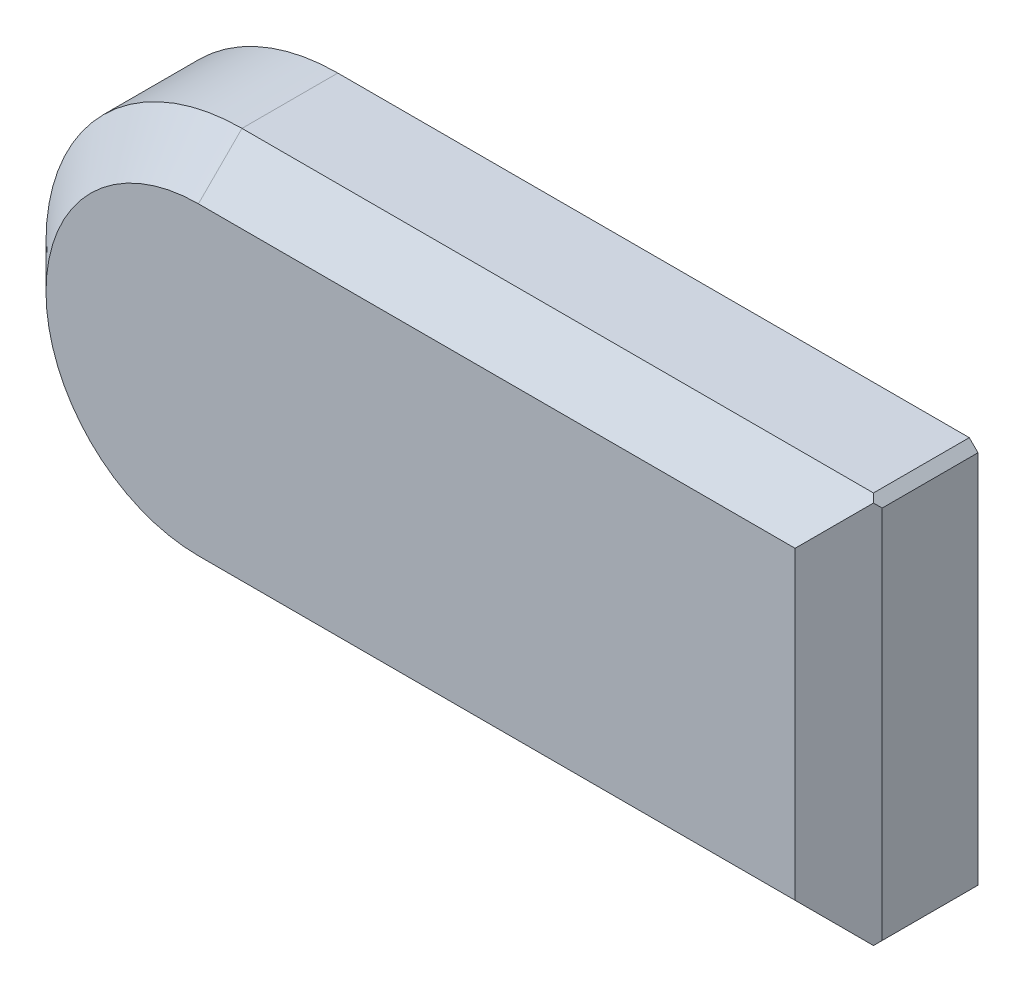
from build123d import *

# Parameters (mm, degrees)
EXTRUDE_1_DEPTH     = 16
CHAMFER_1_SIZE      = 5
SHELL_1_T           = -2.5
CUT_EXTRUDE_1_DEPTH = 1.2
SKETCH_3_R          = 5
EXTRUDE_2_DEPTH     = 12.5
CUT_EXTRUDE_2_DEPTH = 2.4
SKETCH_5_R          = 1.6
CUT_EXTRUDE_3_DEPTH = 6
CHAMFER_2_SIZE      = 1


with BuildPart() as part:
    # 草图1 → 凸台-拉伸1 (new body)
    with BuildSketch(Plane.XY):
        with BuildLine():
            ThreePointArc((-14.25, 0), (-20.840097423, 15.909902577), (-36.75, 22.5))
            Line((-36.75, 22.5), (-36.75, -22.5))
            ThreePointArc((-36.75, -22.5), (-20.840097423, -15.909902577), (-14.25, 0))
        make_face()
        with BuildLine():
            Line((-36.75, -22.5), (-36.75, 22.5))
            ThreePointArc((-36.75, 22.5), (-59.25, 0), (-36.75, -22.5))
        make_face()
        with BuildLine():
            Line((36.75, 22.5), (-36.75, 22.5))
            ThreePointArc((-36.75, 22.5), (-20.840097423, 15.909902577), (-14.25, 0))
            ThreePointArc((-14.25, 0), (-20.840097423, -15.909902577), (-36.75, -22.5))
            Line((-36.75, -22.5), (36.75, -22.5))
            Line((36.75, -22.5), (36.75, 22.5))
        make_face()
    extrude(amount=EXTRUDE_1_DEPTH)

    # 倒角1
    chamfer_1_edges = [part.edges().sort_by_distance(p)[0] for p in [
        (0, -22.5, 16),
        (36.75, 0, 16),
        (0, 22.5, 16),
        (-59.25, 0, 16),
    ]]
    chamfer(chamfer_1_edges, length=CHAMFER_1_SIZE)

    # 抽壳1
    shell_1_openings = [part.faces().sort_by_distance(p)[0] for p in [
        (-8.974037689, 0, 0),
    ]]
    offset(amount=SHELL_1_T, openings=shell_1_openings, kind=Kind.INTERSECTION)

    # 草图2 → 切除-拉伸1 (cut)
    with BuildSketch(Plane(origin=(0, 0, 0), x_dir=(-1, 0, 0), z_dir=(0, 0, -1))):
        with BuildLine():
            Line((36.75, 21.2), (-35.45, 21.2))
            Line((-35.45, 21.2), (-35.45, -21.2))
            Line((-35.45, -21.2), (36.75, -21.2))
            ThreePointArc((36.75, -21.2), (57.95, 0), (36.75, 21.2))
        make_face()
        with BuildLine():
            Line((36.75, -20), (-34.25, -20))
            Line((-34.25, -20), (-34.25, 20))
            Line((-34.25, 20), (36.75, 20))
            ThreePointArc((36.75, 20), (56.75, 0), (36.75, -20))
        make_face(mode=Mode.SUBTRACT)
    extrude(amount=-CUT_EXTRUDE_1_DEPTH, mode=Mode.SUBTRACT)

    # 草图3 → 凸台-拉伸2 (add)
    with BuildSketch(Plane(origin=(0, 0, 13.5), x_dir=(-1, 0, 0), z_dir=(0, 0, -1))):
        with Locations(Location((11.25, 0, 0), (0, 0, 180))):
            Circle(SKETCH_3_R)
    extrude(amount=EXTRUDE_2_DEPTH)

    # 草图4 → 切除-拉伸2 (cut)
    with BuildSketch(Plane(origin=(0, 0, 1), x_dir=(-1, 0, 0), z_dir=(0, 0, -1))):
        Polygon((9.66228676, -2.75), (12.83771324, -2.75), (14.425426481, 0), (12.83771324, 2.75), (9.66228676, 2.75), (8.074573519, 0), align=None)
    extrude(amount=-CUT_EXTRUDE_2_DEPTH, mode=Mode.SUBTRACT)

    # 草图5 → 切除-拉伸3 (cut)
    with BuildSketch(Plane(origin=(0, 0, 3.4), x_dir=(-1, 0, 0), z_dir=(0, 0, -1))):
        with Locations((11.25, 0)):
            Circle(SKETCH_5_R)
    extrude(amount=-CUT_EXTRUDE_3_DEPTH, mode=Mode.SUBTRACT)

    # 倒角2
    chamfer_2_edges = [part.edges().sort_by_distance(p)[0] for p in [
        (36.75, -22.5, 5.5),
        (36.75, 22.5, 5.5),
    ]]
    chamfer(chamfer_2_edges, length=CHAMFER_2_SIZE)


solid = part.part
